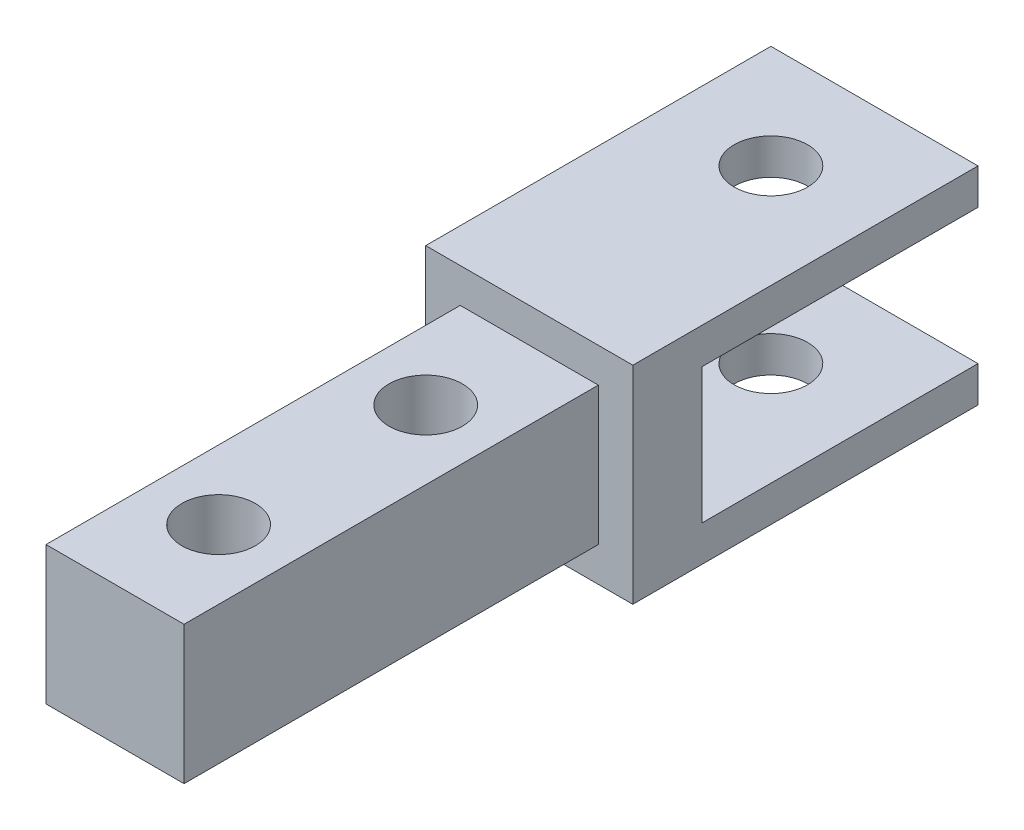
from build123d import *

# Parameters (mm, degrees)
SKETCH1_W                   = 12.7
SKETCH1_H                   = 12.7
BOSS_EXTRUDE1_DEPTH         = 38.1
SKETCH2_W                   = 19.05
SKETCH2_H                   = 19.05
BOSS_EXTRUDE2_DEPTH         = 31.75
SKETCH3_W                   = 25.4
SKETCH3_H                   = 12.446
CUT_EXTRUDE1_DEPTH          = 44.649033494
F_1_4_CLEARANCE_HOLE1_D     = 6.7564
F_1_4_CLEARANCE_HOLE1_DEPTH = 19.05
F_1_4_CLEARANCE_HOLE1_TIP   = 2.029827343


with BuildPart() as part:
    # Sketch1 → Boss-Extrude1 (new body)
    with BuildSketch(Plane.XY):
        Rectangle(SKETCH1_W, SKETCH1_H)
    extrude(amount=BOSS_EXTRUDE1_DEPTH)

    # Sketch2 → Boss-Extrude2 (add)
    with BuildSketch(Plane.XY):
        Rectangle(SKETCH2_W, SKETCH2_H)
    extrude(amount=-BOSS_EXTRUDE2_DEPTH)

    # Sketch3 → Cut-Extrude1 (cut, through all)
    with BuildSketch(Plane.ZY.offset(9.525)):
        with Locations((-19.05, 0)):
            Rectangle(SKETCH3_W, SKETCH3_H)
    extrude(amount=-CUT_EXTRUDE1_DEPTH, mode=Mode.SUBTRACT)

    # 1/4 Clearance Hole1
    with Locations(Plane(origin=(47.625, 9.525, -52.822499938), x_dir=(0, 0, 1), z_dir=(0, 1, 0))):
        with Locations((30.597499938, -47.625), (62.347499938, -47.625), (81.397499938, -47.625), (196.332499938, -47.625)):
            Hole(F_1_4_CLEARANCE_HOLE1_D / 2, depth=F_1_4_CLEARANCE_HOLE1_DEPTH)
            with Locations((0, 0, -(F_1_4_CLEARANCE_HOLE1_DEPTH + F_1_4_CLEARANCE_HOLE1_TIP / 2))):  # 118° drill point
                Cone(0, F_1_4_CLEARANCE_HOLE1_D / 2, F_1_4_CLEARANCE_HOLE1_TIP, mode=Mode.SUBTRACT)


solid = part.part
